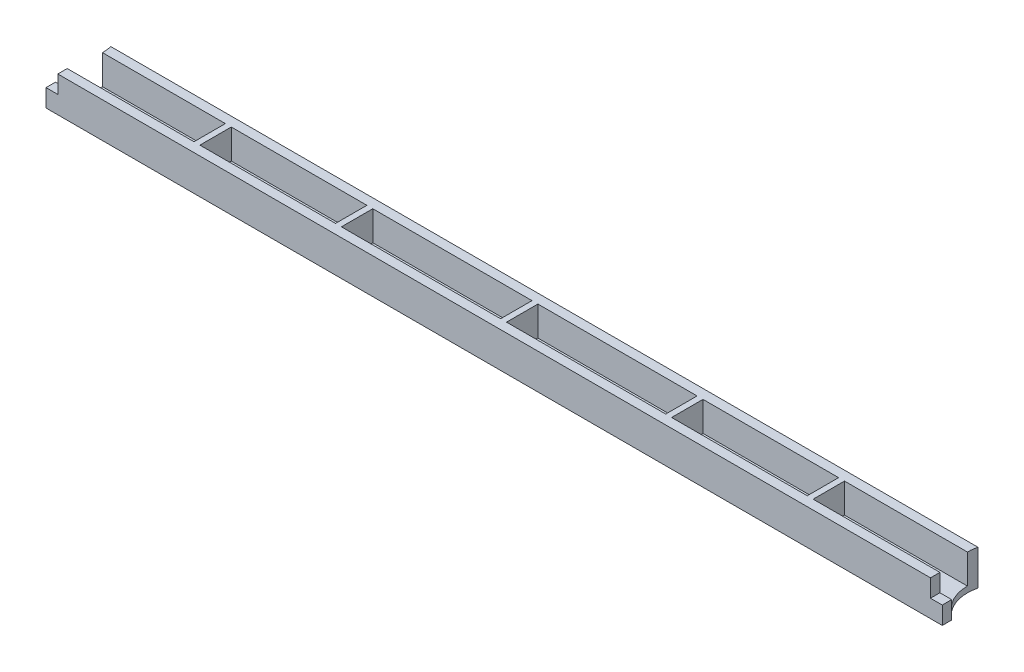
from build123d import *

# Parameters (mm, degrees)
SKETCH2_W               = 120.65
SKETCH2_H               = 9.525
BOSS_EXTRUDE1_DEPTH     = 2.54
SKETCH4_W               = 13.5255
SKETCH4_H               = 1.5875
BOSS_EXTRUDE2_DEPTH     = 120.65
SKETCH13_W              = 120.65
SKETCH13_H              = 2.54
BOSS_EXTRUDE3_DEPTH     = 7.9375
CUT_EXTRUDE4_DEPTH      = 122.664972595
F_6_CLEARANCE_HOLE1_D   = 4.3053
SKETCH15_W              = 1.5875
SKETCH15_H              = 8.4455
SKETCH15_W_2            = 0.79375
BOSS_EXTRUDE4_DEPTH     = 7.9375
CUT_EXTRUDE3_DEPTH      = 122.778845763
CUT_EXTRUDE3_DEPTH_BACK = 122.778845763
SKETCH9_R               = 10.566407632
CUT_EXTRUDE5_REACH      = 123.779
SKETCH16_W              = 3.175
SKETCH16_H              = 4.7625


with BuildPart() as part:
    # Sketch2 → Boss-Extrude1 (new body)
    with BuildSketch(Plane.XY):
        with Locations((60.325, 4.7625)):
            Rectangle(SKETCH2_W, SKETCH2_H)
    extrude(amount=BOSS_EXTRUDE1_DEPTH)

    # Sketch4 → Boss-Extrude2 (add)
    with BuildSketch(Plane.ZY):
        with Locations((6.76275, 0.79375)):
            Rectangle(SKETCH4_W, SKETCH4_H)
    extrude(amount=-BOSS_EXTRUDE2_DEPTH)

    # Sketch13 → Boss-Extrude3 (add)
    with BuildSketch(Plane(origin=(0, 1.5875, 0), x_dir=(1, 0, 0), z_dir=(0, 1, 0))):
        with Locations((60.325, -12.2555)):
            Rectangle(SKETCH13_W, SKETCH13_H)
    extrude(amount=BOSS_EXTRUDE3_DEPTH)

    # Sketch11 → Cut-Extrude4 (cut, through all)
    with BuildSketch(Plane(origin=(0, 1.5875, 0), x_dir=(1, 0, 0), z_dir=(0, 1, 0))):
        with BuildLine():
            Line((63.5, -8.6614), (44.45, -8.6614))
            ThreePointArc((44.45, -8.6614), (42.55135, -6.76275), (44.45, -4.8641))
            Line((44.45, -4.8641), (63.5, -4.8641))
            ThreePointArc((63.5, -4.8641), (65.39865, -6.76275), (63.5, -8.6614))
        make_face()
    extrude(amount=-CUT_EXTRUDE4_DEPTH, mode=Mode.SUBTRACT)

    # #6 Clearance Hole1 (through all)
    with Locations(Plane.XZ):
        with Locations((31.75, 6.76275), (12.7, 6.76275), (107.95, 6.76275)):
            Hole(F_6_CLEARANCE_HOLE1_D / 2)

    # Sketch15 → Boss-Extrude4 (add)
    with BuildSketch(Plane(origin=(0, 1.5875, 0), x_dir=(1, 0, 0), z_dir=(0, 1, 0))):
        with Locations((38.1, -6.76275)):
            Rectangle(SKETCH15_W, SKETCH15_H)
        with Locations((76.2, -6.76275)):
            Rectangle(SKETCH15_W, SKETCH15_H)
        with Locations((120.253125, -6.76275)):
            Rectangle(SKETCH15_W_2, SKETCH15_H)
    extrude(amount=BOSS_EXTRUDE4_DEPTH)

    # Sketch9 → Cut-Extrude3 (cut, two sides: drawn at the far end of the back side and taken through both)
    with BuildSketch(Plane(origin=(0, 0, 0), x_dir=(1, 0, 0), z_dir=(0, 1, 0)).offset(-CUT_EXTRUDE3_DEPTH_BACK)):
        with Locations((-6.35, -2.54)):
            Circle(SKETCH9_R)
    extrude(amount=CUT_EXTRUDE3_DEPTH + CUT_EXTRUDE3_DEPTH_BACK, mode=Mode.SUBTRACT)

    # Sketch16 → Cut-Extrude5 (cut, up to next)
    with BuildSketch(Plane.XY.offset(13.5255), mode=Mode.PRIVATE) as cut_extrude5_sk1:
        with Locations((1.5875, 7.14375)):
            Rectangle(SKETCH16_W, SKETCH16_H)
    cut_extrude5_tool1 = extrude(cut_extrude5_sk1.sketch, amount=-CUT_EXTRUDE5_REACH, mode=Mode.PRIVATE) & part.part
    add(cut_extrude5_tool1.solids().sort_by_distance((1.5875, 7.14375, 13.5255))[0], mode=Mode.SUBTRACT)

    # Mirror1: part across face


with BuildPart() as part_1:
    add(part.part)
    add(part.part.mirror(Plane(origin=(120.65, 4.7625, 6.76275), x_dir=(0, 0, 1), z_dir=(1, 0, 0))))


solid = part_1.part
